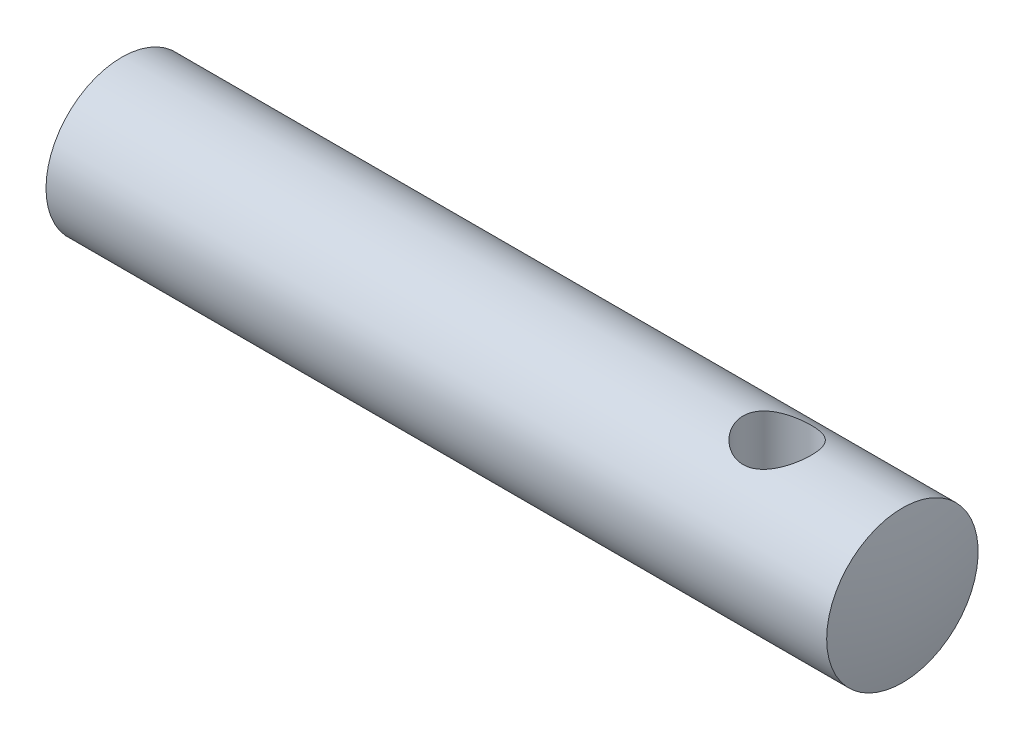
from build123d import *

# Parameters (mm, degrees)
TAGLIO_ESTRUSIONE2_DEPTH      = 11.874281585
TAGLIO_ESTRUSIONE2_DEPTH_BACK = 11.874281585
SCHIZZO3_R                    = 0.9


with BuildPart() as part:
    # Schizzo2 → Rivoluzione1 (revolve)
    with BuildSketch(Plane(origin=(0, 0, 0), x_dir=(1, 0, 0), z_dir=(0, 1, 0))):
        with BuildLine():
            Line((10.5, 0), (-10.5, 0))
            ThreePointArc((-10.5, 0), (-10.451830526, -1.004608712), (-10.307764064, -2))
            Line((-10.307764064, -2), (10.307764064, -2))
            ThreePointArc((10.307764064, -2), (10.451830526, -1.004608712), (10.5, 0))
        make_face()
    revolve(axis=Axis((-10.5, 0, 0), (1, 0, 0)))

    # Schizzo3 → Taglio-Estrusione2 (cut, two sides: drawn at the far end of the back side and taken through both)
    with BuildSketch(Plane(origin=(0, 0, 0), x_dir=(1, 0, 0), z_dir=(0, 1, 0)).offset(-TAGLIO_ESTRUSIONE2_DEPTH_BACK)):
        with Locations(Location((7, 0, 0), (0, 0, 270))):
            Circle(SCHIZZO3_R)
    extrude(amount=TAGLIO_ESTRUSIONE2_DEPTH + TAGLIO_ESTRUSIONE2_DEPTH_BACK, mode=Mode.SUBTRACT)


solid = part.part
